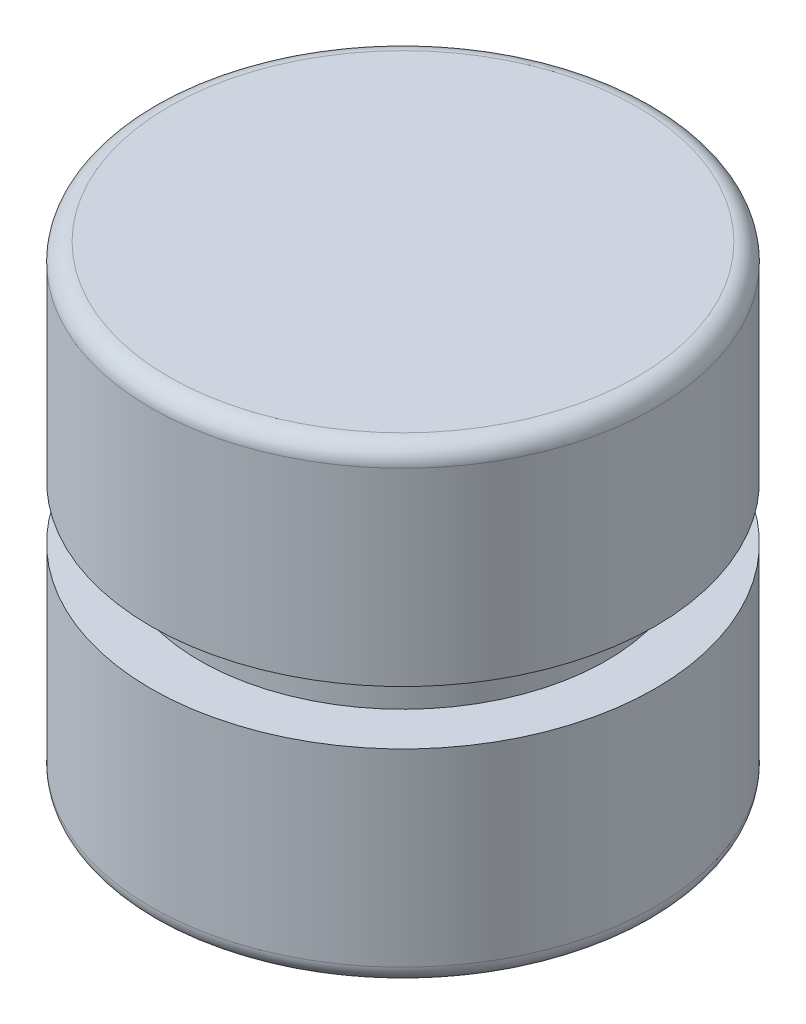
from build123d import *

# Parameters (mm, degrees)
FILLET1_R = 0.635


with BuildPart() as part:
    # Sketch1 → Revolve1 (revolve)
    with BuildSketch(Plane.XY, mode=Mode.PRIVATE) as revolve1_sk:
        Polygon((4.445, 0), (4.445, 12.7), (0, 12.7), (0, 16.51), (8.89, 16.51), (8.89, 9.2075), (7.1755, 9.2075), (7.1755, 7.3025), (8.89, 7.3025), (8.89, 0), align=None)
    revolve(revolve1_sk.sketch.rotate(Axis((0, 0, 0), (0, 1, 0)), 90), axis=Axis((0, 0, 0), (0, 1, 0)))

    # Fillet1
    fillet1_edges = [part.edges().sort_by_distance(p)[0] for p in [
        (0, 16.51, 8.89),
        (0, 0, 8.89),
    ]]
    fillet(fillet1_edges, radius=FILLET1_R)


solid = part.part
